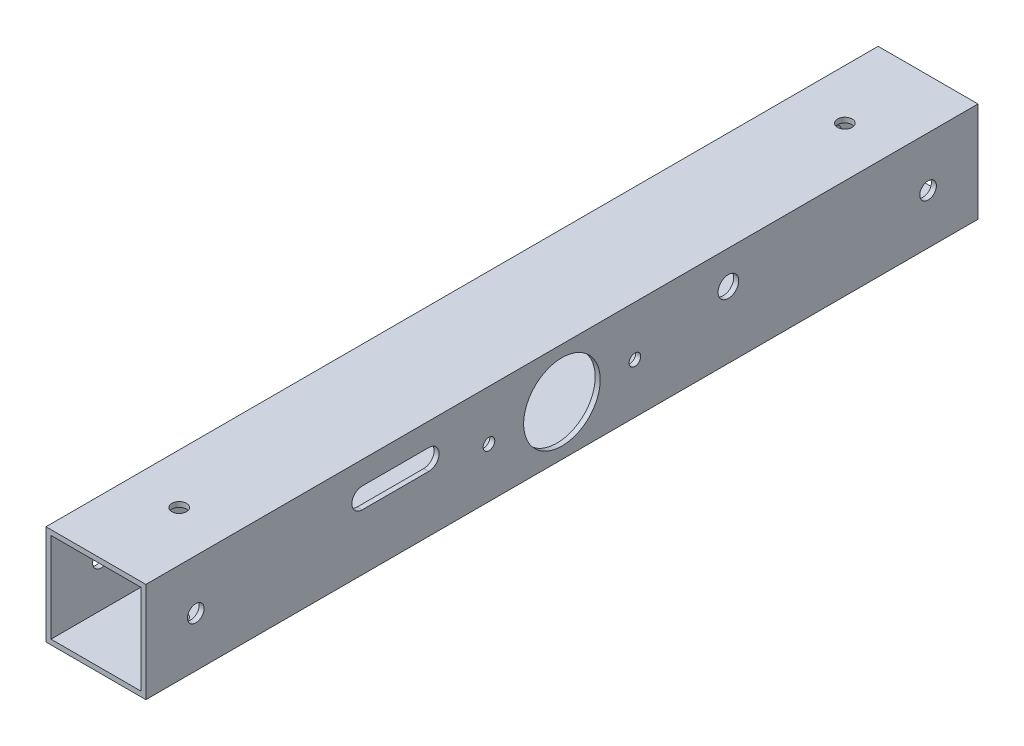
from build123d import *

# Parameters (mm, degrees)
SKETCH1_W           = 30
SKETCH1_H           = 30
SKETCH1_W_2         = 27
SKETCH1_H_2         = 27
BOSS_EXTRUDE1_DEPTH = 250
SKETCH2_R           = 3.1
SKETCH2_R_2         = 2.5
SKETCH2_R_3         = 11.5
SKETCH2_R_4         = 1.75
CUT_EXTRUDE1_DEPTH  = 254.574446662
SKETCH3_R           = 2.2
CUT_EXTRUDE2_DEPTH  = 254.574446662


with BuildPart() as part:
    # Sketch1 → Boss-Extrude1 (new body)
    with BuildSketch(Plane.XY):
        with Locations((15, 15)):
            Rectangle(SKETCH1_W, SKETCH1_H)
        with Locations((15, 15)):
            Rectangle(SKETCH1_W_2, SKETCH1_H_2, mode=Mode.SUBTRACT)
    extrude(amount=BOSS_EXTRUDE1_DEPTH)

    # Sketch2 → Cut-Extrude1 (cut, through all)
    with BuildSketch(Plane(origin=(30, 0, 0), x_dir=(0, 0, -1), z_dir=(1, 0, 0))):
        with Locations((-75, 20)):
            Circle(SKETCH2_R)
        with Locations((-15, 15)):
            Circle(SKETCH2_R_2)
        with Locations((-235, 15)):
            Circle(SKETCH2_R_2)
        with Locations((-125, 15)):
            Circle(SKETCH2_R_3)
        with Locations((-146.92, 15)):
            Circle(SKETCH2_R_4)
        with Locations((-103.08, 15)):
            Circle(SKETCH2_R_4)
        with BuildLine():
            Line((-185, 23.1), (-165, 23.1))
            ThreePointArc((-165, 23.1), (-161.9, 20), (-165, 16.9))
            Line((-165, 16.9), (-185, 16.9))
            ThreePointArc((-185, 16.9), (-188.1, 20), (-185, 23.1))
        make_face()
    extrude(amount=-CUT_EXTRUDE1_DEPTH, mode=Mode.SUBTRACT)

    # Sketch3 → Cut-Extrude2 (cut, through all)
    with BuildSketch(Plane(origin=(0, 30, 0), x_dir=(1, 0, 0), z_dir=(0, 1, 0))):
        with Locations(Location((15, -25, 0), (0, 0, 270))):
            Circle(SKETCH3_R)
        with Locations(Location((15, -225, 0), (0, 0, 270))):
            Circle(SKETCH3_R)
    extrude(amount=-CUT_EXTRUDE2_DEPTH, mode=Mode.SUBTRACT)


solid = part.part
